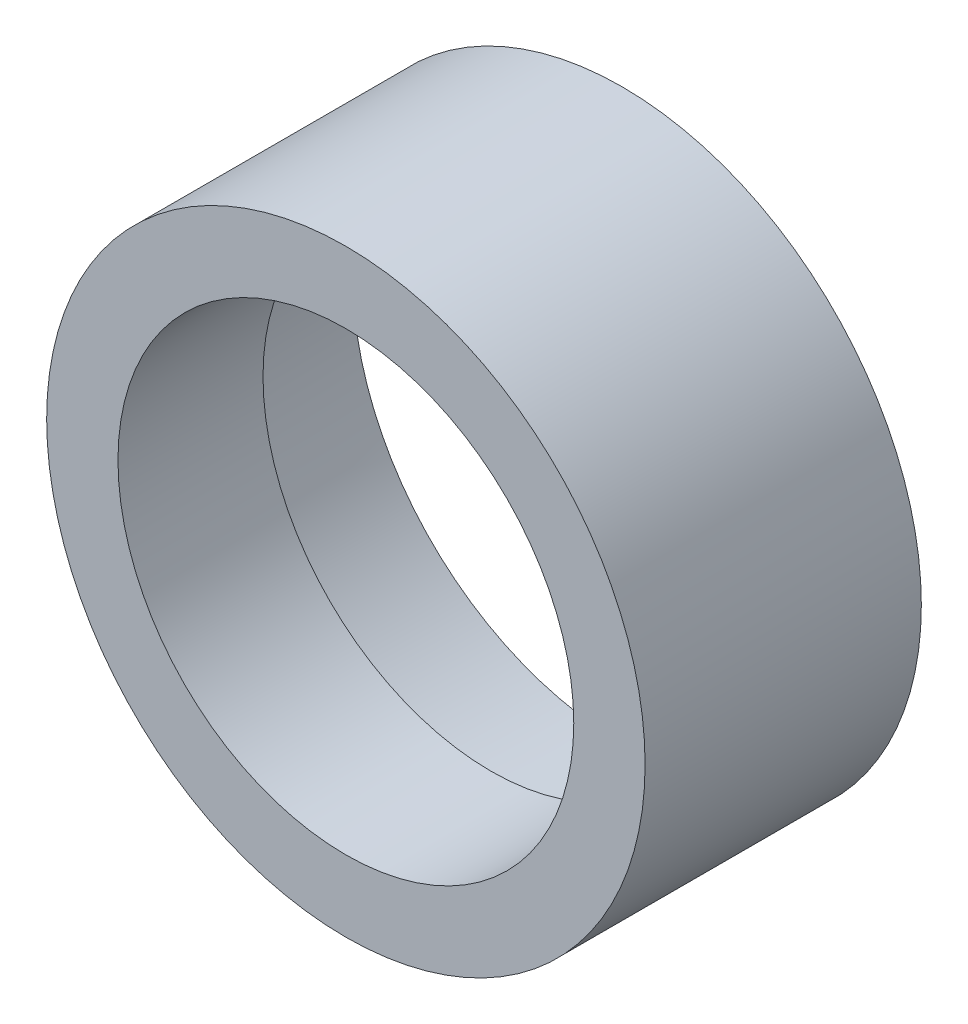
from build123d import *


with BuildPart() as part:
    # Sketch1 → Revolve1 (revolve)
    with BuildSketch(Plane(origin=(0, 0, 0), x_dir=(-1, 0, 0), z_dir=(0, 1, 0)), mode=Mode.PRIVATE) as revolve1_sk:
        Polygon((19.5, 0), (19.25, 8), (16.5, 9.5), (16.5, 20), (21.663295285, 20), (21.663295285, 0), align=None)
    revolve(revolve1_sk.sketch.rotate(Axis((0, 0, 20), (0, 0, -1)), 180), axis=Axis((0, 0, 20), (0, 0, -1)))


solid = part.part
